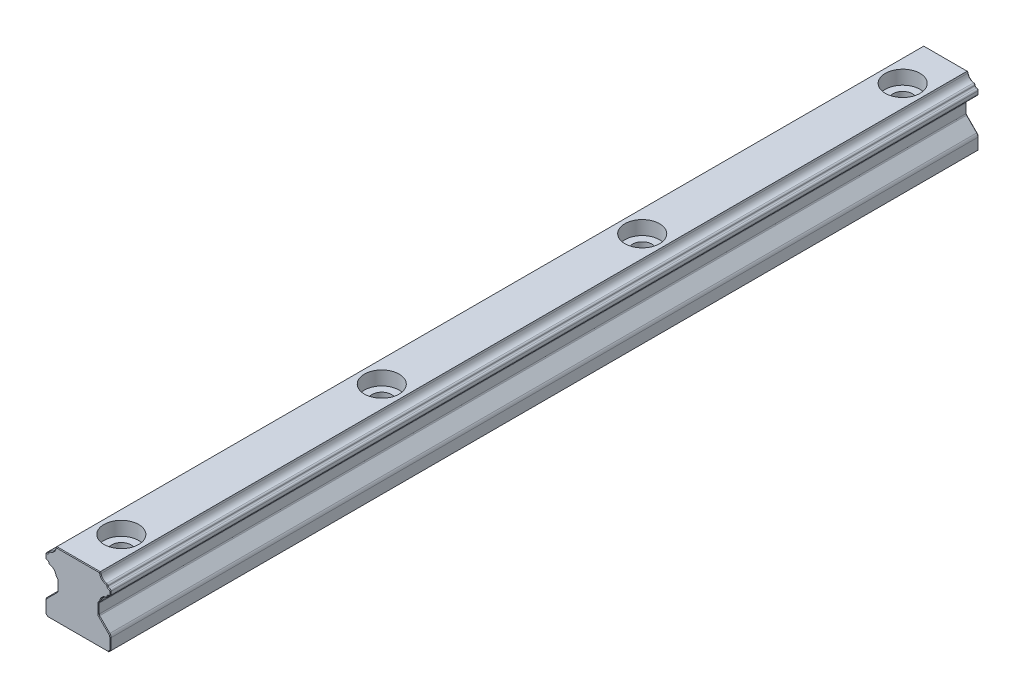
from build123d import *

# Parameters (mm, degrees)
BODY_DEPTH                                          = 200
AESTHETIC_CHAMFER_SIZE                              = 0.15
CBORE_FOR_M4_HEX_SOCKET_HEAD_CAP_SCREW1_D           = 4.5
CBORE_FOR_M4_HEX_SOCKET_HEAD_CAP_SCREW1_CBORE_D     = 8
CBORE_FOR_M4_HEX_SOCKET_HEAD_CAP_SCREW1_CBORE_DEPTH = 3.2
LPATTERN1_COUNT                                     = 4
LPATTERN1_PITCH                                     = 60


with BuildPart() as part:
    # Rail Profile → Body (new body)
    with BuildSketch(Plane.XY):
        with BuildLine():
            Line((-7, 0), (7, 0))
            Line((7, 0), (7.5, 0.5))
            Line((7.5, 0.5), (7.5, 3.085786438))
            ThreePointArc((7.5, 3.085786438), (7.423879533, 3.46846987), (7.207106781, 3.792893219))
            Line((7.207106781, 3.792893219), (4.867157288, 6.132842712))
            ThreePointArc((4.867157288, 6.132842712), (4.780448187, 6.262612052), (4.75, 6.415685425))
            Line((4.75, 6.415685425), (4.75, 8.584314575))
            ThreePointArc((4.75, 8.584314575), (4.780448187, 8.737387948), (4.867157288, 8.867157288))
            Line((4.867157288, 8.867157288), (5.062965362, 9.062965362))
            ThreePointArc((5.062965362, 9.062965362), (5.134996734, 9.161242682), (5.17409812, 9.27664646))
            ThreePointArc((5.17409812, 9.27664646), (5.61862915, 10.13137085), (6.47335354, 10.57590188))
            ThreePointArc((6.47335354, 10.57590188), (6.694124352, 10.694306692), (6.801170165, 10.920803148))
            ThreePointArc((6.801170165, 10.920803148), (6.915305692, 11.154571658), (7.149074202, 11.268707185))
            ThreePointArc((7.149074202, 11.268707185), (7.399691242, 11.400760606), (7.5, 11.665685425))
            Line((7.5, 11.665685425), (7.5, 12.334314575))
            ThreePointArc((7.5, 12.334314575), (7.399691242, 12.599239394), (7.149074202, 12.731292815))
            ThreePointArc((7.149074202, 12.731292815), (6.915305692, 12.845428342), (6.801170165, 13.079196852))
            ThreePointArc((6.801170165, 13.079196852), (6.694124352, 13.305693308), (6.47335354, 13.42409812))
            ThreePointArc((6.47335354, 13.42409812), (5.61862915, 13.86862915), (5.17409812, 14.72335354))
            ThreePointArc((5.17409812, 14.72335354), (5.134996734, 14.838757318), (5.062965362, 14.937034638))
            Line((5.062965362, 14.937034638), (5, 15))
            Line((5, 15), (-5, 15))
            Line((-5, 15), (-5.062965362, 14.937034638))
            ThreePointArc((-5.062965362, 14.937034638), (-5.134996734, 14.838757318), (-5.17409812, 14.72335354))
            ThreePointArc((-5.17409812, 14.72335354), (-5.61862915, 13.86862915), (-6.47335354, 13.42409812))
            ThreePointArc((-6.47335354, 13.42409812), (-6.694124352, 13.305693308), (-6.801170165, 13.079196852))
            ThreePointArc((-6.801170165, 13.079196852), (-6.915305692, 12.845428342), (-7.149074202, 12.731292815))
            ThreePointArc((-7.149074202, 12.731292815), (-7.399691242, 12.599239394), (-7.5, 12.334314575))
            Line((-7.5, 12.334314575), (-7.5, 11.665685425))
            ThreePointArc((-7.5, 11.665685425), (-7.399691242, 11.400760606), (-7.149074202, 11.268707185))
            ThreePointArc((-7.149074202, 11.268707185), (-6.915305692, 11.154571658), (-6.801170165, 10.920803148))
            ThreePointArc((-6.801170165, 10.920803148), (-6.694124352, 10.694306692), (-6.47335354, 10.57590188))
            ThreePointArc((-6.47335354, 10.57590188), (-5.61862915, 10.13137085), (-5.17409812, 9.27664646))
            ThreePointArc((-5.17409812, 9.27664646), (-5.134996734, 9.161242682), (-5.062965362, 9.062965362))
            Line((-5.062965362, 9.062965362), (-4.867157288, 8.867157288))
            ThreePointArc((-4.867157288, 8.867157288), (-4.780448187, 8.737387948), (-4.75, 8.584314575))
            Line((-4.75, 8.584314575), (-4.75, 6.415685425))
            ThreePointArc((-4.75, 6.415685425), (-4.780448187, 6.262612052), (-4.867157288, 6.132842712))
            Line((-4.867157288, 6.132842712), (-7.207106781, 3.792893219))
            ThreePointArc((-7.207106781, 3.792893219), (-7.423879533, 3.46846987), (-7.5, 3.085786438))
            Line((-7.5, 3.085786438), (-7.5, 0.5))
            Line((-7.5, 0.5), (-7, 0))
        make_face()
    extrude(amount=-BODY_DEPTH)

    # Aesthetic Chamfer
    aesthetic_chamfer_edges = [part.edges().sort_by_distance(p)[0] for p in [
        (7.423879533, 3.46846987, -200),
        (-5.134996734, 9.161242682, -200),
        (-4.965061325, 8.965061325, -200),
        (-4.780448187, 8.737387948, -200),
        (-4.75, 7.5, -200),
        (-4.780448187, 6.262612052, -200),
        (-6.037132034, 4.962867966, -200),
        (-7.423879533, 3.46846987, -200),
        (-7.5, 1.792893219, -200),
        (-7.25, 0.25, -200),
        (0, 0, -200),
        (6.037132034, 4.962867966, -200),
        (4.780448187, 6.262612052, -200),
        (4.75, 7.5, -200),
        (4.780448187, 8.737387948, -200),
        (4.965061325, 8.965061325, -200),
        (5.134996734, 9.161242682, -200),
        (5.61862915, 10.13137085, -200),
        (6.694124352, 10.694306692, -200),
        (0, 0, 0),
        (-7.25, 0.25, 0),
        (-7.5, 1.792893219, 0),
        (-7.423879533, 3.46846987, 0),
        (-6.037132034, 4.962867966, 0),
        (-4.780448187, 6.262612052, 0),
        (6.915305692, 11.154571658, -200),
        (-4.75, 7.5, 0),
        (-4.780448187, 8.737387948, 0),
        (-4.965061325, 8.965061325, 0),
        (-5.134996734, 9.161242682, 0),
        (-5.61862915, 10.13137085, 0),
        (-6.694124352, 10.694306692, 0),
        (-6.915305692, 11.154571658, 0),
        (7.25, 0.25, -200),
        (7.399691242, 11.400760606, -200),
        (-7.399691242, 11.400760606, 0),
        (-7.5, 12, 0),
        (-7.399691242, 12.599239394, 0),
        (-6.915305692, 12.845428342, 0),
        (-6.694124352, 13.305693308, 0),
        (-5.61862915, 13.86862915, 0),
        (-5.134996734, 14.838757318, 0),
        (-5.031482681, 14.968517319, 0),
        (7.5, 12, -200),
        (0, 15, 0),
        (5.031482681, 14.968517319, 0),
        (5.134996734, 14.838757318, 0),
        (5.61862915, 13.86862915, 0),
        (6.694124352, 13.305693308, 0),
        (6.915305692, 12.845428342, 0),
        (7.399691242, 12.599239394, 0),
        (7.399691242, 12.599239394, -200),
        (7.5, 12, 0),
        (7.399691242, 11.400760606, 0),
        (6.915305692, 11.154571658, 0),
        (6.694124352, 10.694306692, 0),
        (5.61862915, 10.13137085, 0),
        (5.134996734, 9.161242682, 0),
        (4.965061325, 8.965061325, 0),
        (4.780448187, 8.737387948, 0),
        (6.915305692, 12.845428342, -200),
        (4.75, 7.5, 0),
        (4.780448187, 6.262612052, 0),
        (6.037132034, 4.962867966, 0),
        (7.423879533, 3.46846987, 0),
        (7.5, 1.792893219, 0),
        (7.25, 0.25, 0),
        (6.694124352, 13.305693308, -200),
        (5.61862915, 13.86862915, -200),
        (5.134996734, 14.838757318, -200),
        (5.031482681, 14.968517319, -200),
        (0, 15, -200),
        (-5.031482681, 14.968517319, -200),
        (7.5, 1.792893219, -200),
        (-5.134996734, 14.838757318, -200),
        (-5.61862915, 13.86862915, -200),
        (-6.694124352, 13.305693308, -200),
        (-6.915305692, 12.845428342, -200),
        (-7.399691242, 12.599239394, -200),
        (-7.5, 12, -200),
        (-7.399691242, 11.400760606, -200),
        (-6.915305692, 11.154571658, -200),
        (-6.694124352, 10.694306692, -200),
        (-5.61862915, 10.13137085, -200),
    ]]
    chamfer(aesthetic_chamfer_edges, length=AESTHETIC_CHAMFER_SIZE)

    # CBORE for M4 Hex Socket Head Cap Screw1 (through all)
    with Locations(Plane(origin=(0, 15, 0), x_dir=(1, 0, 0), z_dir=(0, 1, 0))):
        with Locations((0, 10)):
            cbore_for_m4_hex_socket_head_cap_screw1 = CounterBoreHole(CBORE_FOR_M4_HEX_SOCKET_HEAD_CAP_SCREW1_D / 2, CBORE_FOR_M4_HEX_SOCKET_HEAD_CAP_SCREW1_CBORE_D / 2, CBORE_FOR_M4_HEX_SOCKET_HEAD_CAP_SCREW1_CBORE_DEPTH)

    # LPattern1: CBORE for M4 Hex Socket Head Cap Screw1 ×4
    with Locations(*[(0, 0, -i * LPATTERN1_PITCH) for i in range(1, LPATTERN1_COUNT)]):
        add(cbore_for_m4_hex_socket_head_cap_screw1, mode=Mode.SUBTRACT)


solid = part.part
